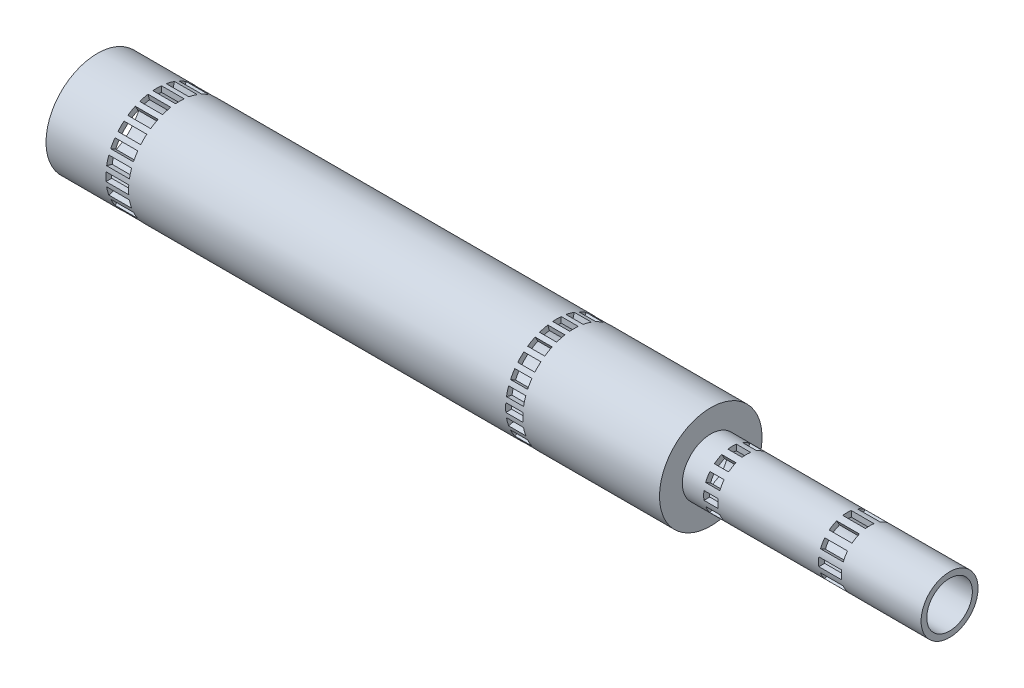
from build123d import *

# Parameters (mm, degrees)
SHELL1_T            = -2
SKETCH2_W           = 3.537461388
SKETCH2_H           = 3
CUT_EXTRUDE1_DEPTH  = 8
CIRPATTERN1_COUNT   = 24
SKETCH4_W           = 4.87635607
SKETCH4_H           = 3
CUT_EXTRUDE2_DEPTH  = 6
CIRPATTERN2_COUNT   = 24
SKETCH6_W           = 8
SKETCH6_H           = 3
CUT_EXTRUDE3_DEPTH  = 8
CIRPATTERN5_COUNT   = 12
SKETCH7_W           = 5
SKETCH7_H           = 3
CUT_EXTRUDE28_DEPTH = 5
CIRPATTERN7_COUNT   = 12


with BuildPart() as part:
    # Sketch1 → Revolve2 (revolve)
    with BuildSketch(Plane.XY, mode=Mode.PRIVATE) as revolve2_sk:
        Polygon((216.636824399, 10), (215.347319492, 10), (215.347319492, 10.316039257), (215.347319492, 18), (0, 18), (0, 0), (299.165138456, 0), (299.165138456, 10), align=None)
    revolve(revolve2_sk.sketch.rotate(Axis((0, 0, 0), (1, 0, 0)), 90), axis=Axis((0, 0, 0), (1, 0, 0)))

    # Shell1
    shell1_openings = [part.faces().sort_by_distance(p)[0] for p in [
        (0, 0, 0),
        (299.165138456, 0, 0),
    ]]
    offset(amount=SHELL1_T, openings=shell1_openings, kind=Kind.INTERSECTION)

    # Sketch2 → Cut-Extrude1 (cut)
    with BuildSketch(Plane.ZY.offset(-21)):
        with Locations((-16.927427161, 0)):
            Rectangle(SKETCH2_W, SKETCH2_H)
    cut_extrude1 = extrude(amount=-CUT_EXTRUDE1_DEPTH, mode=Mode.SUBTRACT)

    # CirPattern1: Cut-Extrude1 ×24 about axis
    cirpattern1_axis = Axis((0, 0, 0), (1, 0, 0))
    for i in range(1, CIRPATTERN1_COUNT):
        add(cut_extrude1.rotate(cirpattern1_axis, i * 360 / CIRPATTERN1_COUNT), mode=Mode.SUBTRACT)

    # Sketch4 → Cut-Extrude2 (cut)
    with BuildSketch(Plane(origin=(167.347319492, 0, 0), x_dir=(0, 0, -1), z_dir=(1, 0, 0))):
        with Locations((-18, 0)):
            Rectangle(SKETCH4_W, SKETCH4_H)
    cut_extrude2 = extrude(amount=-CUT_EXTRUDE2_DEPTH, mode=Mode.SUBTRACT)

    # CirPattern2: Cut-Extrude2 ×24 about axis
    cirpattern2_axis = Axis((0, 0, 0), (1, 0, 0))
    for i in range(1, CIRPATTERN2_COUNT):
        add(cut_extrude2.rotate(cirpattern2_axis, i * 360 / CIRPATTERN2_COUNT), mode=Mode.SUBTRACT)

    # Sketch6 → Cut-Extrude3 (cut)
    with BuildSketch(Plane(origin=(271.165138456, 0, 0), x_dir=(0, 0, -1), z_dir=(1, 0, 0))):
        with Locations((-10.043306552, 0)):
            Rectangle(SKETCH6_W, SKETCH6_H)
    cut_extrude3 = extrude(amount=-CUT_EXTRUDE3_DEPTH, mode=Mode.SUBTRACT)

    # CirPattern5: Cut-Extrude3 ×12 about axis
    cirpattern5_axis = Axis((0, 0, 0), (1, 0, 0))
    for i in range(1, CIRPATTERN5_COUNT):
        add(cut_extrude3.rotate(cirpattern5_axis, i * 360 / CIRPATTERN5_COUNT), mode=Mode.SUBTRACT)

    # Sketch7 → Cut-Extrude28 (cut)
    with BuildSketch(Plane(origin=(227.847319492, 0, 0), x_dir=(0, 0, -1), z_dir=(1, 0, 0))):
        with Locations((-8.04876325, 0)):
            Rectangle(SKETCH7_W, SKETCH7_H)
    cut_extrude28 = extrude(amount=-CUT_EXTRUDE28_DEPTH, mode=Mode.SUBTRACT)

    # CirPattern7: Cut-Extrude28 ×12 about axis
    cirpattern7_axis = Axis((0, 0, 0), (1, 0, 0))
    for i in range(1, CIRPATTERN7_COUNT):
        add(cut_extrude28.rotate(cirpattern7_axis, i * 360 / CIRPATTERN7_COUNT), mode=Mode.SUBTRACT)


solid = part.part
